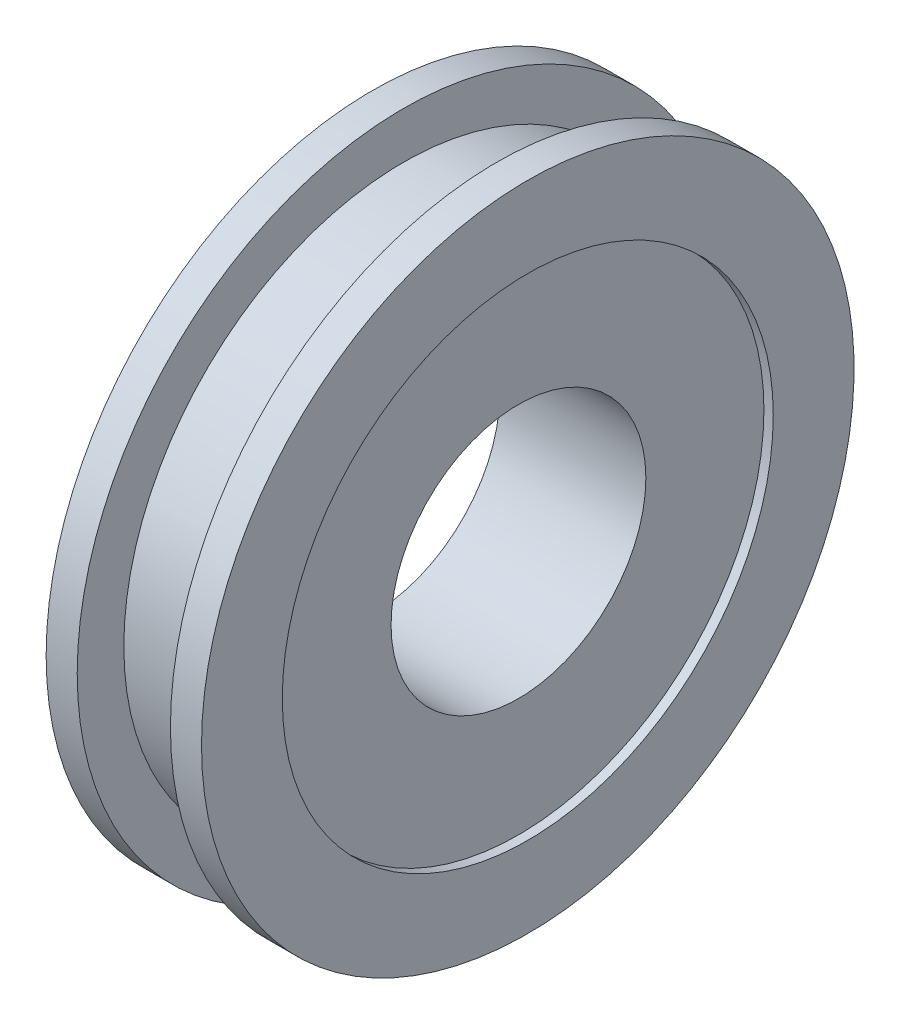
from build123d import *

# Parameters (mm, degrees)
SKETCH1_W          = 5
SKETCH1_H          = 6.4
SKETCH2_W          = 3
SKETCH2_H          = 1.5
SKETCH3_R          = 7.9
CUT_EXTRUDE1_DEPTH = 0.8
CUT_EXTRUDE2_DEPTH = 1


with BuildPart() as part:
    # Sketch1 → Revolve1 (revolve)
    with BuildSketch(Plane.XY, mode=Mode.PRIVATE) as revolve1_sk:
        with Locations((-3, 7.3)):
            Rectangle(SKETCH1_W, SKETCH1_H)
    revolve(revolve1_sk.sketch.rotate(Axis((0, 0, 0), (1, 0, 0)), 90), axis=Axis((0, 0, 0), (1, 0, 0)))

    # Sketch2 → Cut-Revolve1 (revolve, cut)
    with BuildSketch(Plane.XY, mode=Mode.PRIVATE) as cut_revolve1_sk:
        with Locations((-3, 9.75)):
            Rectangle(SKETCH2_W, SKETCH2_H)
    revolve(cut_revolve1_sk.sketch.rotate(Axis((0, 0, 0), (1, 0, 0)), 90), axis=Axis((0, 0, 0), (1, 0, 0)), mode=Mode.SUBTRACT)

    # Sketch3 → Cut-Extrude1 (cut)
    with BuildSketch(Plane(origin=(0, 0, 0), x_dir=(0, 0, -1), z_dir=(1, 0, 0))):
        Circle(SKETCH3_R)
    extrude(amount=-CUT_EXTRUDE1_DEPTH, mode=Mode.SUBTRACT)

    # Sketch5 → Cut-Extrude2 (cut)
    # profile 1 of 2: a face of its own
    with BuildSketch(Plane.ZY.offset(5.5)):
        Polygon((-1.793384415, 7.675), (-0.9125, 7.675), (-0.9125, 4.5), (-1.482371795, 4.5), (-1.482371795, 7.145833333), (-2.133653846, 7.145833333), align=None)
    # profile 2 of 2: a face of its own
    with BuildSketch(Plane.ZY.offset(5.5)):
        with BuildLine():
            add(Edge.make_bspline(
                [(1.786758814, 6.209615385), (1.820052688, 6.185826012), (1.885954908, 6.138737096), (1.972987633, 6.054375541), (2.047953153, 5.960269248), (2.110064245, 5.856995446), (2.159825779, 5.747092633), (2.195447488, 5.631735537), (2.218073988, 5.511941637), (2.220545477, 5.430382608), (2.221794872, 5.389152644)],
                knots=[0, 0, 0, 0, 1.013736912, 2.006600758, 2.994453809, 3.989973287, 4.987781207, 5.978959008, 6.978317308, 8, 8, 8, 8], degree=3))
            add(Edge.make_bspline(
                [(2.221794872, 5.389152644), (2.220287572, 5.34450785), (2.217298037, 5.255960631), (2.190866551, 5.126106148), (2.14843186, 5.00135344), (2.090436575, 4.883079461), (2.017721153, 4.774959714), (1.932964566, 4.679242926), (1.836059971, 4.598428905), (1.745839049, 4.543597114), (1.668182749, 4.507173392), (1.605514797, 4.483862941), (1.539341558, 4.46334135), (1.469190831, 4.446945961), (1.395075371, 4.434146669), (1.31710095, 4.42569404), (1.235216239, 4.419549495), (1.179374328, 4.418915055), (1.150741186, 4.418589744)],
                knots=[0, 0, 0, 0, 1.313679292, 2.605514271, 3.884962679, 5.186178731, 6.472827995, 7.711026938, 8.938935107, 10.174644318, 10.808706728, 11.462743532, 12.142127587, 12.847854939, 13.582806024, 14.355735269, 15.156897313, 16, 16, 16, 16], degree=3))
            add(Edge.make_bspline(
                [(1.150741186, 4.418589744), (1.120206781, 4.41900393), (1.060579108, 4.419812753), (0.973535988, 4.424703329), (0.891428611, 4.433719654), (0.814084743, 4.445588948), (0.741578798, 4.461295464), (0.673908628, 4.481210467), (0.610910835, 4.503885913), (0.533798227, 4.538411225), (0.4456725, 4.592329893), (0.350424526, 4.671292228), (0.266821174, 4.765338836), (0.194135977, 4.871829843), (0.136842765, 4.990110116), (0.094237825, 5.116467223), (0.069006675, 5.250558751), (0.065969127, 5.342404855), (0.064423077, 5.389152644)],
                knots=[0, 0, 0, 0, 0.886964665, 1.7320671, 2.531131818, 3.285397207, 4.004107883, 4.684213108, 5.332925796, 5.947568694, 7.135706876, 8.320776993, 9.52873045, 10.778999824, 12.05415135, 13.333578234, 14.642845846, 16, 16, 16, 16], degree=3))
            add(Edge.make_bspline(
                [(0.064423077, 5.389152644), (0.065835907, 5.4299324), (0.068612291, 5.510069557), (0.088499898, 5.627495836), (0.122601102, 5.738829844), (0.169393262, 5.844846641), (0.229730957, 5.945558024), (0.30397099, 6.040222955), (0.391172072, 6.129695445), (0.457298282, 6.182533521), (0.491190905, 6.209615385)],
                knots=[0, 0, 0, 0, 1.01821053, 2.000906977, 2.963938143, 3.919209931, 4.888045165, 5.887808425, 6.917407893, 8, 8, 8, 8], degree=3))
            add(Edge.make_bspline(
                [(0.491190905, 6.209615385), (0.470179277, 6.233849224), (0.428813708, 6.281558356), (0.375286255, 6.358342401), (0.33019163, 6.437506832), (0.291904146, 6.518409188), (0.263601062, 6.602442406), (0.242197406, 6.68828531), (0.230091519, 6.776812445), (0.228199332, 6.836482365), (0.22724359, 6.866621595)],
                knots=[0, 0, 0, 0, 1.061529281, 2.089831458, 3.092927091, 4.075998741, 5.048384512, 6.024008542, 7.00192825, 8, 8, 8, 8], degree=3))
            add(Edge.make_bspline(
                [(0.22724359, 6.866621595), (0.228510758, 6.907421227), (0.231010833, 6.987917329), (0.25315385, 7.105621637), (0.289916635, 7.217464189), (0.339929274, 7.323117526), (0.403437554, 7.420279049), (0.47889914, 7.507411214), (0.567374874, 7.581322406), (0.665574579, 7.64474147), (0.773990481, 7.695184406), (0.89159394, 7.730480594), (1.016964877, 7.752824943), (1.103366784, 7.755196971), (1.147561098, 7.756410256)],
                knots=[0, 0, 0, 0, 1.022455555, 2.017265428, 2.990720743, 3.968117071, 4.939886797, 5.893155559, 6.847550415, 7.820889576, 8.817530429, 9.83499769, 10.892607882, 12, 12, 12, 12], degree=3))
            add(Edge.make_bspline(
                [(1.147561098, 7.756410256), (1.191118898, 7.755194985), (1.276047488, 7.752825462), (1.399215198, 7.730629167), (1.514277223, 7.694546749), (1.620282085, 7.643038738), (1.717466215, 7.579497441), (1.804438236, 7.503012731), (1.879663021, 7.413710397), (1.94369846, 7.314035335), (1.994724865, 7.206649897), (2.032448506, 7.094033972), (2.054268305, 6.977072732), (2.057399401, 6.897661569), (2.058974359, 6.857717348)],
                knots=[0, 0, 0, 0, 1.094655142, 2.134348324, 3.136019022, 4.118575226, 5.088726318, 6.048298823, 7.020513804, 8.015920439, 9.020015034, 10.003048569, 10.995523219, 12, 12, 12, 12], degree=3))
            add(Edge.make_bspline(
                [(2.058974359, 6.857717348), (2.058215664, 6.829486932), (2.056726782, 6.774086853), (2.045718289, 6.692466901), (2.027181337, 6.614152447), (2.00133663, 6.537250953), (1.965403664, 6.459672577), (1.916778006, 6.379930777), (1.857631279, 6.294712264), (1.811180399, 6.238938489), (1.786758814, 6.209615385)],
                knots=[0, 0, 0, 0, 0.940746401, 1.846144481, 2.739104268, 3.619506754, 4.545839139, 5.581956076, 6.728711598, 8, 8, 8, 8], degree=3))
        make_face()
        with BuildLine():
            add(Edge.make_bspline(
                [(1.13356871, 7.186538462), (1.110105898, 7.185407337), (1.064465545, 7.183207049), (0.999342106, 7.163347019), (0.940794009, 7.130864527), (0.890157731, 7.086162225), (0.848633343, 7.031922679), (0.8181152, 6.969563237), (0.80001758, 6.899853484), (0.798101595, 6.851041394), (0.797115385, 6.825916466)],
                knots=[0, 0, 0, 0, 1.018099191, 1.980427864, 2.929421084, 3.909248076, 4.895556904, 5.880788387, 6.909183412, 8, 8, 8, 8], degree=3))
            add(Edge.make_bspline(
                [(0.797115385, 6.825916466), (0.798333656, 6.800576967), (0.800712448, 6.751099152), (0.819418974, 6.680050049), (0.851304765, 6.615659356), (0.89508374, 6.559271984), (0.948282285, 6.513216409), (1.007848346, 6.478041724), (1.074442524, 6.457961409), (1.120719086, 6.455238447), (1.14438101, 6.453846154)],
                knots=[0, 0, 0, 0, 1.07118507, 2.091592095, 3.082435519, 4.092579768, 5.090825648, 6.043203473, 6.999459622, 8, 8, 8, 8], degree=3))
            add(Edge.make_bspline(
                [(1.14438101, 6.453846154), (1.168490274, 6.454924942), (1.215459644, 6.457026624), (1.282220098, 6.477627967), (1.342362736, 6.510575617), (1.393866019, 6.557156306), (1.436526559, 6.613564099), (1.467595246, 6.679080076), (1.485477259, 6.752473276), (1.487864571, 6.803768386), (1.489102564, 6.83036859)],
                knots=[0, 0, 0, 0, 1.008803858, 1.965339183, 2.900766489, 3.864508618, 4.855158575, 5.849593072, 6.884859315, 8, 8, 8, 8], degree=3))
            add(Edge.make_bspline(
                [(1.489102564, 6.83036859), (1.487833255, 6.855476908), (1.485378456, 6.904035512), (1.467776605, 6.973749787), (1.435449925, 7.035135947), (1.392976839, 7.089038677), (1.339726971, 7.132507876), (1.277907775, 7.164475387), (1.207974461, 7.183016853), (1.158907715, 7.185339172), (1.13356871, 7.186538462)],
                knots=[0, 0, 0, 0, 1.065910571, 2.061433587, 3.023559535, 3.990682701, 4.956464619, 5.918590567, 6.925120432, 8, 8, 8, 8], degree=3))
        make_face(mode=Mode.SUBTRACT)
        with BuildLine():
            add(Edge.make_bspline(
                [(1.152013221, 5.883974359), (1.13418326, 5.883678266), (1.09904063, 5.88309467), (1.047378076, 5.876364936), (0.997802545, 5.866335968), (0.950375546, 5.852501289), (0.905336675, 5.833641141), (0.862304152, 5.810904884), (0.821426594, 5.784062683), (0.783310327, 5.753601858), (0.748862129, 5.720168201), (0.717810211, 5.68529798), (0.692429653, 5.648089706), (0.671293699, 5.609780194), (0.654310841, 5.570065862), (0.643083888, 5.528292696), (0.635855302, 5.485016998), (0.634818075, 5.455539347), (0.634294872, 5.440670072)],
                knots=[0, 0, 0, 0, 1.129580664, 2.226389355, 3.296443603, 4.333934503, 5.352185725, 6.386189251, 7.41493955, 8.447544828, 9.47401038, 10.455044306, 11.4018853, 12.322125673, 13.225630306, 14.132028716, 15.057747923, 16, 16, 16, 16], degree=3))
            add(Edge.make_bspline(
                [(0.634294872, 5.440670072), (0.63454424, 5.425162887), (0.63503883, 5.394406304), (0.642508927, 5.349514587), (0.653264548, 5.306219609), (0.66837116, 5.264926636), (0.688573384, 5.225659711), (0.712695206, 5.188037072), (0.741577744, 5.152322538), (0.774437858, 5.118707595), (0.81122461, 5.088380917), (0.850872666, 5.061662584), (0.892858367, 5.038106335), (0.938442094, 5.021140191), (0.985935698, 5.005611286), (1.036611549, 4.996190273), (1.089916154, 4.98925803), (1.126335289, 4.988731586), (1.145017027, 4.988461538)],
                knots=[0, 0, 0, 0, 0.973817353, 1.931446211, 2.852767904, 3.776304432, 4.688323523, 5.623710549, 6.581246645, 7.570897993, 8.57436511, 9.572506873, 10.574556662, 11.591826551, 12.624694332, 13.712108235, 14.826391851, 16, 16, 16, 16], degree=3))
            add(Edge.make_bspline(
                [(1.145017027, 4.988461538), (1.163901485, 4.988803842), (1.200701313, 4.989470882), (1.25449526, 4.995366257), (1.305374788, 5.004720502), (1.353279122, 5.018099252), (1.398389413, 5.035237963), (1.440100547, 5.057052151), (1.479364857, 5.081773696), (1.514920581, 5.110655854), (1.547385577, 5.142131378), (1.57535873, 5.176625875), (1.599143992, 5.213030128), (1.618329397, 5.251737483), (1.633810296, 5.292565228), (1.644429222, 5.335920457), (1.651018647, 5.381315958), (1.651618364, 5.412238245), (1.651923077, 5.42794972)],
                knots=[0, 0, 0, 0, 1.200705402, 2.339794563, 3.437264955, 4.487414319, 5.499029866, 6.500076882, 7.476298407, 8.444948224, 9.407950986, 10.347155707, 11.263432813, 12.167927724, 13.089546445, 14.03463663, 15.00140776, 16, 16, 16, 16], degree=3))
            add(Edge.make_bspline(
                [(1.651923077, 5.42794972), (1.651341254, 5.443866599), (1.650203992, 5.474978582), (1.643981063, 5.520922743), (1.632307482, 5.564478525), (1.617035028, 5.606656097), (1.596719157, 5.646582665), (1.571497443, 5.684173963), (1.542788942, 5.720361173), (1.509235047, 5.753533371), (1.472549081, 5.783864551), (1.433502717, 5.810886303), (1.392216224, 5.833771234), (1.348576668, 5.852478529), (1.3024246, 5.866343167), (1.254112164, 5.876364584), (1.203718609, 5.883096176), (1.169419787, 5.88367872), (1.152013221, 5.883974359)],
                knots=[0, 0, 0, 0, 1.011708178, 1.977538892, 2.938094892, 3.871441737, 4.823268678, 5.775953079, 6.743660653, 7.753304209, 8.767430709, 9.76505158, 10.765940967, 11.761741361, 12.775867861, 13.822051386, 14.89469657, 16, 16, 16, 16], degree=3))
        make_face(mode=Mode.SUBTRACT)
    extrude(amount=-CUT_EXTRUDE2_DEPTH, mode=Mode.SUBTRACT)


solid = part.part
